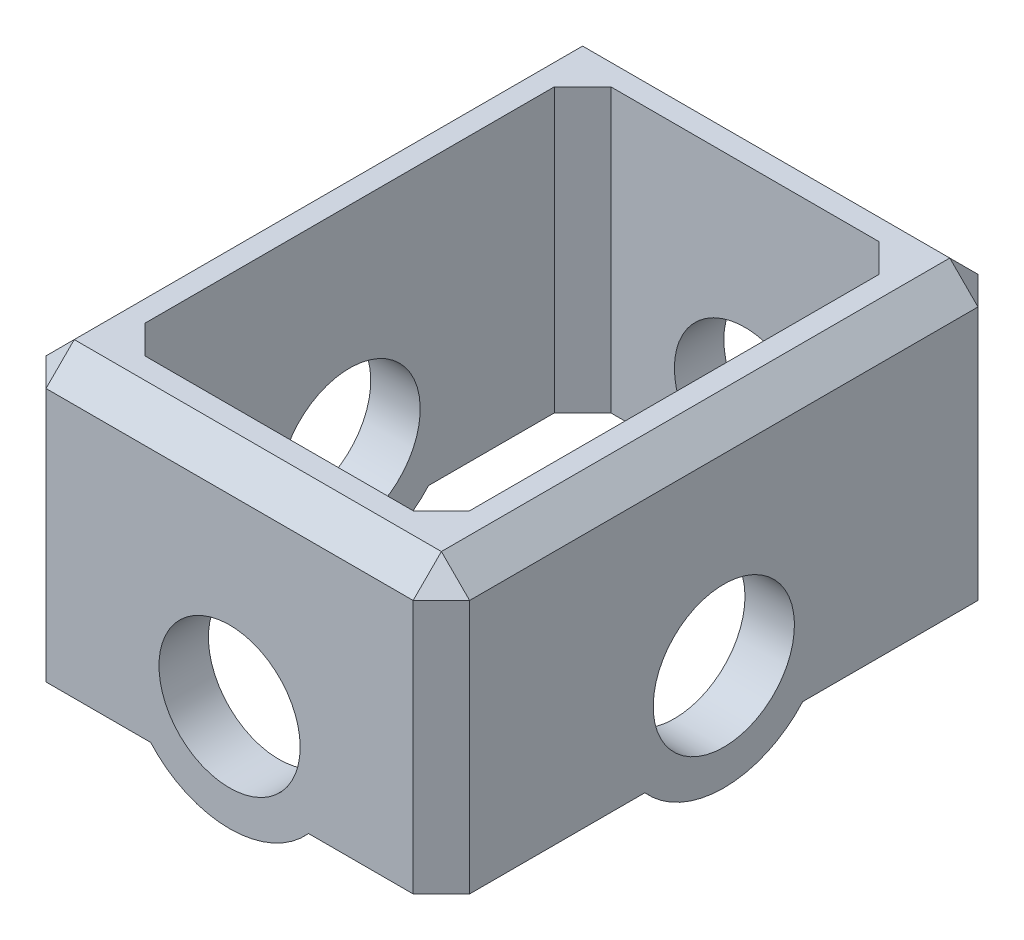
from build123d import *

# Parameters (mm, degrees)
SKETCH1_R           = 5
BOSS_EXTRUDE1_DEPTH = 40
CUT_EXTRUDE1_REACH  = 50.283
SKETCH3_W           = 23
SKETCH3_H           = 33
BOSS_EXTRUDE2_DEPTH = 3.5
CHAMFER1_SIZE       = 2
SKETCH6_R           = 5
CUT_EXTRUDE8_DEPTH  = 52.53882032


with BuildPart() as part:
    # Sketch1 → Boss-Extrude1 (new body)
    with BuildSketch(Plane.XY):
        with BuildLine():
            ThreePointArc((-5.590169944, -10), (0, -12.5), (5.590169944, -10))
            Line((5.590169944, -10), (15, -10))
            Line((15, -10), (15, 10))
            Line((15, 10), (-15, 10))
            Line((-15, 10), (-15, -10))
            Line((-15, -10), (-5.590169944, -10))
        make_face()
        with Locations((0, -5)):
            Circle(SKETCH1_R, mode=Mode.SUBTRACT)
    extrude(amount=BOSS_EXTRUDE1_DEPTH)

    # Sketch3 → Cut-Extrude1 (cut, up to next)
    with BuildSketch(Plane(origin=(0, 10, 0), x_dir=(1, 0, 0), z_dir=(0, 1, 0)), mode=Mode.PRIVATE) as cut_extrude1_sk1:
        with Locations((0, -20)):
            Rectangle(SKETCH3_W, SKETCH3_H)
    cut_extrude1_tool1 = extrude(cut_extrude1_sk1.sketch, amount=-CUT_EXTRUDE1_REACH, mode=Mode.PRIVATE) & part.part
    add(cut_extrude1_tool1.solids().sort_by_distance((0, 10, 20))[0], mode=Mode.SUBTRACT)

    # Sketch4 → Boss-Extrude2 (add)
    with BuildSketch(Plane.ZY.offset(15)):
        with BuildLine():
            Line((25.590169944, -10), (14.409830056, -10))
            ThreePointArc((14.409830056, -10), (20, -12.5), (25.590169944, -10))
        make_face()
    boss_extrude2 = extrude(amount=-BOSS_EXTRUDE2_DEPTH)

    # Mirror1: Boss-Extrude2 across plane
    add(boss_extrude2.mirror(Plane(origin=(0, 0, 0), x_dir=(0, 0, 1), z_dir=(1, 0, 0))))

    # Chamfer1
    chamfer1_edges = [part.edges().sort_by_distance(p)[0] for p in [
        (15, 0, 0),
        (-15, 10, 20),
        (15, 10, 20),
        (15, 0, 40),
        (0, 10, 40),
        (-15, 0, 40),
        (-11.5, 0, 36.5),
        (-11.5, 0, 3.5),
        (11.5, 0, 3.5),
        (11.5, 0, 36.5),
        (-15, 0, 0),
        (0, 10, 0),
    ]]
    chamfer(chamfer1_edges, length=CHAMFER1_SIZE)

    # Sketch6 → Cut-Extrude8 (cut, through all)
    with BuildSketch(Plane.ZY.offset(15)):
        with Locations(Location((20, -5, 0), (0, 0, 270))):
            Circle(SKETCH6_R)
    extrude(amount=-CUT_EXTRUDE8_DEPTH, mode=Mode.SUBTRACT)


solid = part.part
